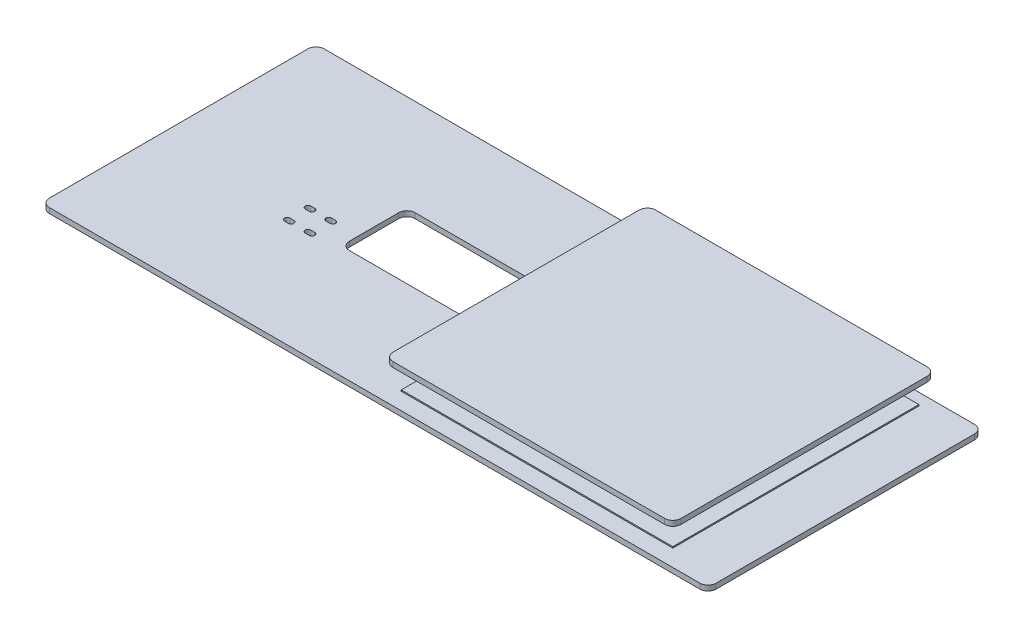
from build123d import *

# Parameters (mm, degrees)
SKETCH1_W           = 331
SKETCH1_H           = 300
BOSS_EXTRUDE1_DEPTH = 1.53
SKETCH3_W           = 812.8
SKETCH3_H           = 335
BOSS_EXTRUDE2_DEPTH = 6.35
CUT_EXTRUDE1_DEPTH  = 6.35
FILLET1_R           = 10
BOSS_EXTRUDE3_START = 30
SKETCH5_W           = 351
SKETCH5_H           = 320
BOSS_EXTRUDE3_DEPTH = 6.35
FILLET2_R           = 10
SKETCH6_W           = 177.8
SKETCH6_H           = 80
CUT_EXTRUDE2_DEPTH  = 6.35
FILLET3_R           = 10


with BuildPart() as part:
    # Sketch1 → Boss-Extrude1 (new body)
    with BuildSketch(Plane(origin=(0, 0, 0), x_dir=(1, 0, 0), z_dir=(0, 1, 0))):
        with Locations((180.5, 0)):
            Rectangle(SKETCH1_W, SKETCH1_H)
    extrude(amount=BOSS_EXTRUDE1_DEPTH)


with BuildPart() as body_2:
    # Sketch3 → Boss-Extrude2 (new body)
    with BuildSketch(Plane(origin=(0, -3, 0), x_dir=(1, 0, 0), z_dir=(0, 1, 0))):
        Rectangle(SKETCH3_W, SKETCH3_H)
    extrude(amount=-BOSS_EXTRUDE2_DEPTH)

    # Sketch4 → Cut-Extrude1 (cut)
    with BuildSketch(Plane.XZ.offset(9.35)):
        with BuildLine():
            Line((-208.5105, 6.550865079), (-213.5105, 6.550865079))
            ThreePointArc((-213.5105, 6.550865079), (-216.8125, 9.852865079), (-213.5105, 13.154865079))
            Line((-213.5105, 13.154865079), (-208.5105, 13.154865079))
            ThreePointArc((-208.5105, 13.154865079), (-205.2085, 9.852865079), (-208.5105, 6.550865079))
        make_face()
        with BuildLine():
            Line((-233.9105, 6.550865079), (-238.9105, 6.550865079))
            ThreePointArc((-238.9105, 6.550865079), (-242.2125, 9.852865079), (-238.9105, 13.154865079))
            Line((-238.9105, 13.154865079), (-233.9105, 13.154865079))
            ThreePointArc((-233.9105, 13.154865079), (-230.6085, 9.852865079), (-233.9105, 6.550865079))
        make_face()
        with BuildLine():
            Line((-208.5105, 31.950865079), (-213.5105, 31.950865079))
            ThreePointArc((-213.5105, 31.950865079), (-216.8125, 35.252865079), (-213.5105, 38.554865079))
            Line((-213.5105, 38.554865079), (-208.5105, 38.554865079))
            ThreePointArc((-208.5105, 38.554865079), (-205.2085, 35.252865079), (-208.5105, 31.950865079))
        make_face()
        with BuildLine():
            Line((-233.9105, 31.950865079), (-238.9105, 31.950865079))
            ThreePointArc((-238.9105, 31.950865079), (-242.2125, 35.252865079), (-238.9105, 38.554865079))
            Line((-238.9105, 38.554865079), (-233.9105, 38.554865079))
            ThreePointArc((-233.9105, 38.554865079), (-230.6085, 35.252865079), (-233.9105, 31.950865079))
        make_face()
    cut_extrude1 = extrude(amount=-CUT_EXTRUDE1_DEPTH, mode=Mode.SUBTRACT)

    # Mirror1: Cut-Extrude1 across plane
    add(cut_extrude1.mirror(Plane.ZY), mode=Mode.SUBTRACT)

    # Fillet1
    fillet1_edges = [body_2.edges().sort_by_distance(p)[0] for p in [
        (-406.4, -6.175, -167.5),
        (-406.4, -6.175, 167.5),
        (406.4, -6.175, 167.5),
        (406.4, -6.175, -167.5),
    ]]
    fillet(fillet1_edges, radius=FILLET1_R)

    # Sketch6 → Cut-Extrude2 (cut)
    with BuildSketch(Plane.XZ.offset(9.35)):
        with Locations((-89.1875, -9.999173431)):
            Rectangle(SKETCH6_W, SKETCH6_H)
    extrude(amount=-CUT_EXTRUDE2_DEPTH, mode=Mode.SUBTRACT)

    # Fillet3
    fillet3_edges = [body_2.edges().sort_by_distance(p)[0] for p in [
        (-0.2875, -6.175, 30.000826569),
        (-0.2875, -6.175, -49.999173431),
        (-178.0875, -6.175, 30.000826569),
        (-178.0875, -6.175, -49.999173431),
    ]]
    fillet(fillet3_edges, radius=FILLET3_R)


with BuildPart() as body_3:
    # Sketch5 → Boss-Extrude3 (new body)
    with BuildSketch(Plane(origin=(0, 0, 0), x_dir=(1, 0, 0), z_dir=(0, 1, 0)).offset(BOSS_EXTRUDE3_START)):
        with Locations((180.5, 0)):
            Rectangle(SKETCH5_W, SKETCH5_H)
    extrude(amount=BOSS_EXTRUDE3_DEPTH)

    # Fillet2
    fillet2_edges = [body_3.edges().sort_by_distance(p)[0] for p in [
        (5, 33.175, -160),
        (5, 33.175, 160),
        (356, 33.175, 160),
        (356, 33.175, -160),
    ]]
    fillet(fillet2_edges, radius=FILLET2_R)


solid = Compound([part.part, body_2.part, body_3.part])
